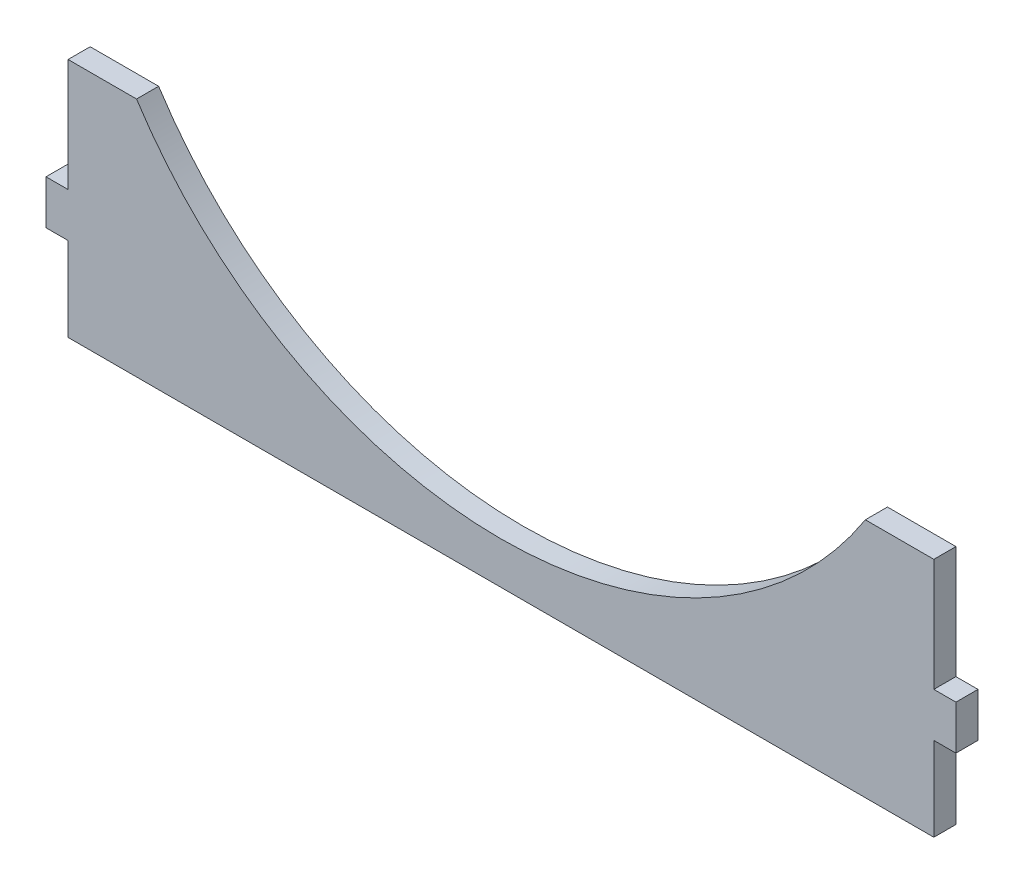
from build123d import *

# Parameters (mm, degrees)
BOSS_EXTRU_1_DEPTH = 5


with BuildPart() as part:
    # Esquisse1 → Boss.-Extru.1 (new body)
    with BuildSketch(Plane.XY):
        with BuildLine():
            Line((0, 0), (-15.5, 0))
            Line((-15.5, 0), (-15.5, -25.5))
            Line((-15.5, -25.5), (-20.5, -25.5))
            Line((-20.5, -25.5), (-20.5, -35.5))
            Line((-20.5, -35.5), (-15.5, -35.5))
            Line((-15.5, -35.5), (-15.5, -54.5))
            Line((-15.5, -54.5), (180.5, -54.5))
            Line((180.5, -54.5), (180.5, -35.5))
            Line((180.5, -35.5), (185.5, -35.5))
            Line((185.5, -35.5), (185.5, -25.5))
            Line((185.5, -25.5), (180.5, -25.5))
            Line((180.5, -25.5), (180.5, 0))
            Line((180.5, 0), (165, 0))
            ThreePointArc((165, 0), (82.5, -45), (0, 0))
        make_face()
    extrude(amount=BOSS_EXTRU_1_DEPTH)


solid = part.part
